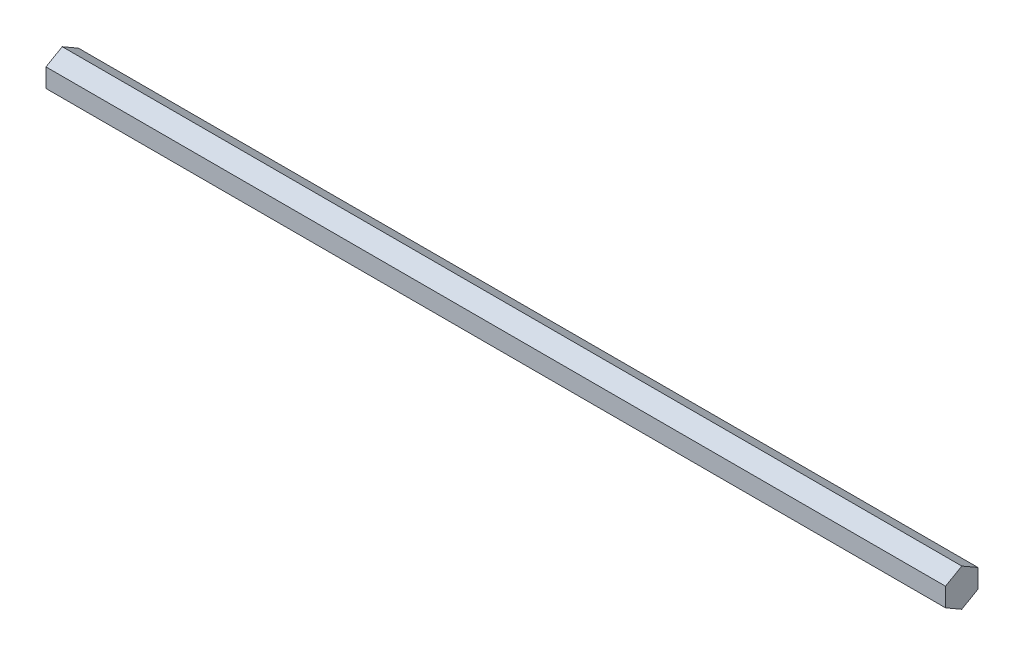
from build123d import *

# Parameters (mm, degrees)
AXLE_DEPTH       = 228.6
DRIVE_SLOT_DEPTH = 13.97


with BuildPart() as part:
    # Hex Profile → Axle (new body)
    with BuildSketch(Plane(origin=(0, 0, 0), x_dir=(0, 0, -1), z_dir=(1, 0, 0))):
        Polygon((4.124445986, -2.38125), (4.124445986, 2.38125), (0, 4.7625), (-4.124445986, 2.38125), (-4.124445986, -2.38125), (0, -4.7625), align=None)
    extrude(amount=AXLE_DEPTH)

    # Motor Shaft Profile → Drive  Slot (cut)
    with BuildSketch(Plane.ZY):
        with BuildLine():
            Line((-1.669458355, 2.4892), (1.669458355, 2.4892))
            ThreePointArc((1.669458355, 2.4892), (0, -2.9972), (-1.669458355, 2.4892))
        make_face()
    extrude(amount=-DRIVE_SLOT_DEPTH, mode=Mode.SUBTRACT)


solid = part.part
